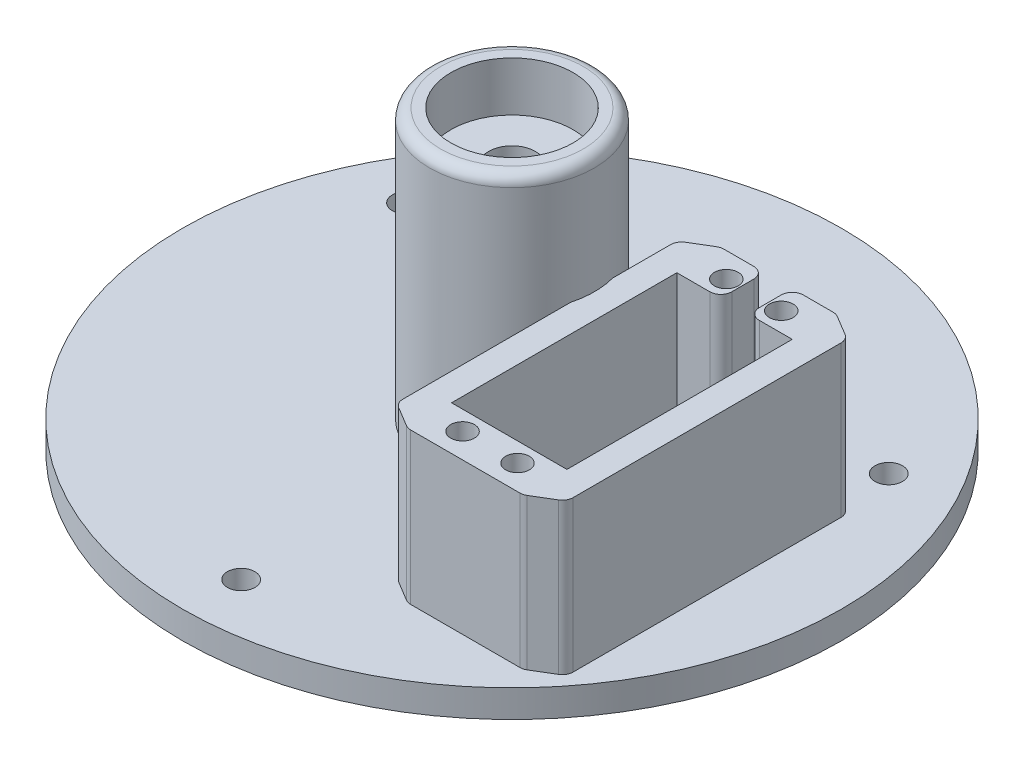
from build123d import *

# Parameters (mm, degrees)
SKETCH1_R           = 60
SKETCH1_R_2         = 4.25
BOSS_EXTRUDE1_DEPTH = 5
SERVO_HOUSING_DEPTH = 27.5
SKETCH4_R           = 2.155
CUT_EXTRUDE1_DEPTH  = 6
SKETCH5_R           = 15
SKETCH5_R_2         = 4.25
BOSS_EXTRUDE2_DEPTH = 49
BEARING_CUT_R       = 11.11
CUT_EXTRUDE2_DEPTH  = 18
CUT_EXTRUDE3_START  = -9
SKETCH6_R           = 11.11
CUT_EXTRUDE3_DEPTH  = 9
SKETCH8_R           = 12.5
CUT_EXTRUDE4_DEPTH  = 10
FILLET1_R           = 2
FILLET2_R           = 2
FILLET5_R           = 2
SKETCH9_R           = 2.5
CUT_EXTRUDE5_DEPTH  = 10


with BuildPart() as part:
    # Sketch1 → Boss-Extrude1 (new body)
    with BuildSketch(Plane(origin=(0, 0, 0), x_dir=(1, 0, 0), z_dir=(0, 1, 0))):
        with Locations(Location((0, 0, 0), (0, 0, 270))):
            Circle(SKETCH1_R)
        with Locations(Location((0, 0, 0), (0, 0, 270))):
            Circle(SKETCH1_R_2, mode=Mode.SUBTRACT)
    extrude(amount=BOSS_EXTRUDE1_DEPTH)

    # Sketch2 → Servo housing (add)
    with BuildSketch(Plane(origin=(0, 5, 0), x_dir=(1, 0, 0), z_dir=(0, 1, 0))):
        Polygon((19.5, 10.5), (27.5, 10.5), (27.5, 18.5), (19.5, 18.5), (14.5, 15.5), (14.5, -35.5), (19.5, -38.5), (40.5, -38.5), (45.5, -35.5), (45.5, 15.5), (40.5, 18.5), (32.5, 18.5), (32.5, 10.5), (40.5, 10.5), (40.5, -30.5), (19.5, -30.5), align=None)
    extrude(amount=SERVO_HOUSING_DEPTH)

    # Sketch4 → Cut-Extrude1 (cut)
    with BuildSketch(Plane(origin=(0, 32.5, 0), x_dir=(1, 0, 0), z_dir=(0, 1, 0))):
        with Locations(Location((25, -34, 0), (0, 0, 270))):
            Circle(SKETCH4_R)
        with Locations(Location((25, 14, 0), (0, 0, 270))):
            Circle(SKETCH4_R)
        with Locations(Location((35, -34, 0), (0, 0, 90))):
            Circle(SKETCH4_R)
        with Locations(Location((35, 14, 0), (0, 0, 90))):
            Circle(SKETCH4_R)
    extrude(amount=-CUT_EXTRUDE1_DEPTH, mode=Mode.SUBTRACT)

    # Sketch5 → Boss-Extrude2 (add)
    with BuildSketch(Plane(origin=(0, 5, 0), x_dir=(1, 0, 0), z_dir=(0, 1, 0))):
        with Locations(Location((0, 0, 0), (0, 0, 14.835111582))):
            Circle(SKETCH5_R)
        with Locations(Location((0, 0, 0), (0, 0, 270))):
            Circle(SKETCH5_R_2, mode=Mode.SUBTRACT)
    extrude(amount=BOSS_EXTRUDE2_DEPTH)

    # Bearing cut → Cut-Extrude2 (cut)
    with BuildSketch(Plane.XZ):
        with Locations(Location((0, 0, 0), (0, 0, 270))):
            Circle(BEARING_CUT_R)
    extrude(amount=-CUT_EXTRUDE2_DEPTH, mode=Mode.SUBTRACT)

    # Sketch6 → Cut-Extrude3 (cut)
    with BuildSketch(Plane(origin=(0, 54, 0), x_dir=(1, 0, 0), z_dir=(0, 1, 0)).offset(CUT_EXTRUDE3_START)):
        with Locations(Location((0, 0, 0), (0, 0, 90))):
            Circle(SKETCH6_R)
    extrude(amount=CUT_EXTRUDE3_DEPTH, mode=Mode.SUBTRACT)

    # Sketch8 → Cut-Extrude4 (cut)
    with BuildSketch(Plane(origin=(0, 0, 0), x_dir=(-1, 0, 0), z_dir=(0, -1, 0))):
        with Locations(Location((0, 0, 0), (0, 0, 90))):
            Circle(SKETCH8_R)
    extrude(amount=-CUT_EXTRUDE4_DEPTH, mode=Mode.SUBTRACT)

    # Fillet1
    fillet1_edges = [part.edges().sort_by_distance(p)[0] for p in [
        (27.5, 18.75, -10.5),
        (32.5, 18.75, -10.5),
    ]]
    fillet(fillet1_edges, radius=FILLET1_R)

    # Fillet2
    fillet2_edges = [part.edges().sort_by_distance(p)[0] for p in [
        (27.5, 18.75, -18.5),
        (19.5, 18.75, -18.5),
        (14.5, 18.75, -15.5),
        (14.5, 18.75, 35.5),
        (19.5, 18.75, 38.5),
        (40.5, 18.75, 38.5),
        (45.5, 18.75, 35.5),
        (45.5, 18.75, -15.5),
        (40.5, 18.75, -18.5),
        (32.5, 18.75, -18.5),
    ]]
    fillet(fillet2_edges, radius=FILLET2_R)

    # Fillet5
    fillet5_edges = [part.edges().sort_by_distance(p)[0] for p in [
        (-14.5, 54, 3.840572874),
    ]]
    fillet(fillet5_edges, radius=FILLET5_R)

    # Sketch9 → Cut-Extrude5 (cut)
    with BuildSketch(Plane.XZ):
        with Locations(Location((0.712812299, 50, 0), (0, 0, 270))):
            Circle(SKETCH9_R)
        with Locations(Location((42.94486404, -25.617313559, 0), (0, 0, 270))):
            Circle(SKETCH9_R)
        with Locations(Location((-43.657676339, -24.382686441, 0), (0, 0, 270))):
            Circle(SKETCH9_R)
    extrude(amount=-CUT_EXTRUDE5_DEPTH, mode=Mode.SUBTRACT)


solid = part.part
